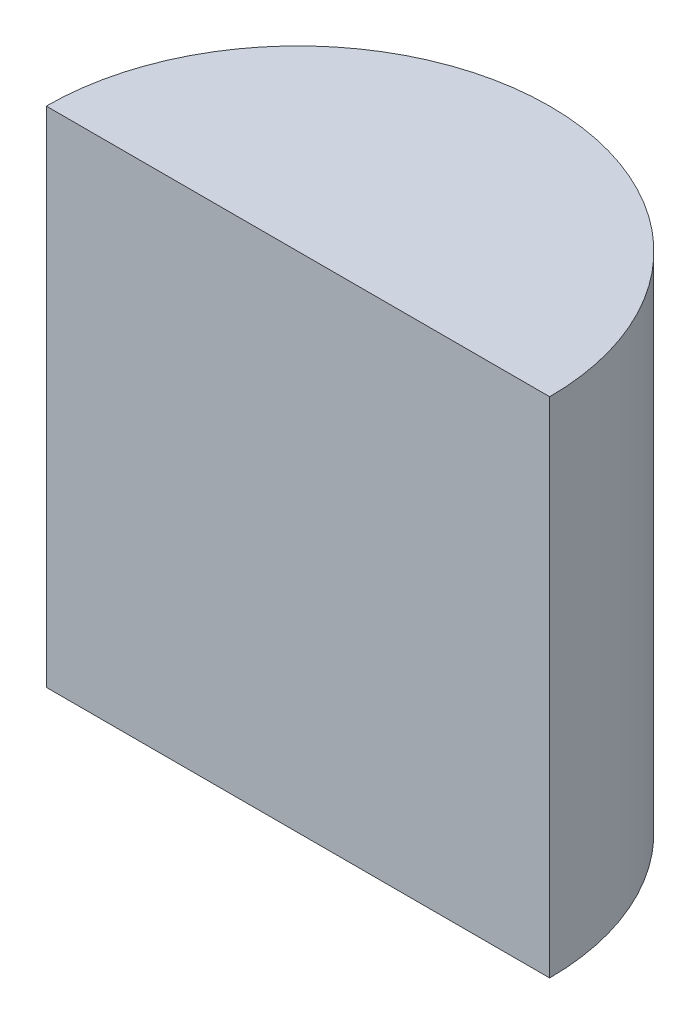
from build123d import *

# Parameters (mm, degrees)
BOSS_EXTRUDE1_DEPTH = 10


with BuildPart() as part:
    # Sketch1 → Boss-Extrude1 (new body)
    with BuildSketch(Plane(origin=(0, 0, 0), x_dir=(1, 0, 0), z_dir=(0, 1, 0))):
        with BuildLine():
            Line((-5, 0), (5, 0))
            ThreePointArc((5, 0), (0, 5), (-5, 0))
        make_face()
    extrude(amount=BOSS_EXTRUDE1_DEPTH)


solid = part.part
